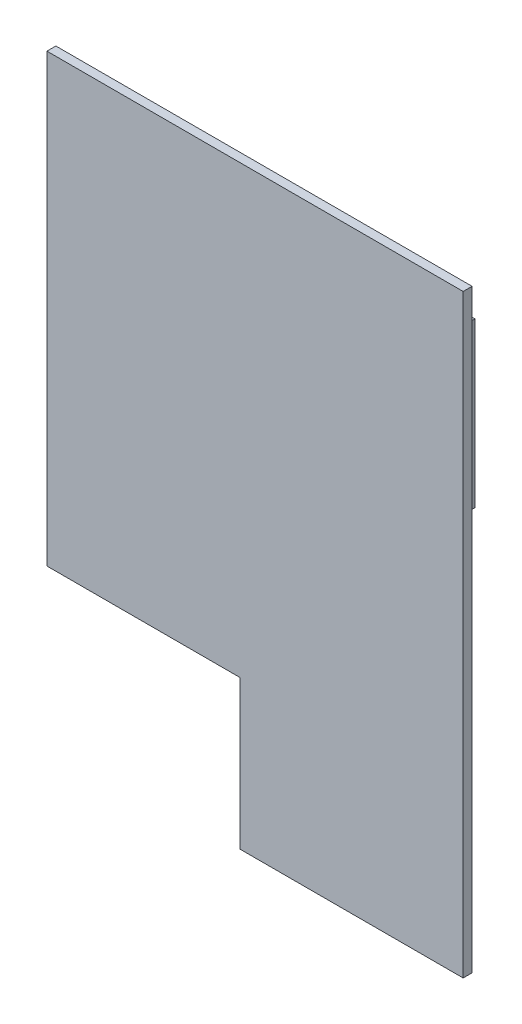
from build123d import *

# Parameters (mm, degrees)
SKETCH_1_W          = 140
SKETCH_1_H          = 200
EXTRUDE_1_DEPTH     = 3
SKETCH_2_W          = 65
SKETCH_2_H          = 50
CUT_EXTRUDE_1_DEPTH = 10
SKETCH_4_W          = 3
SKETCH_4_H          = 55
EXTRUDE_4_DEPTH     = 18
CUT_EXTRUDE_2_REACH = 244.211
SKETCH_5_R          = 1.5
SKETCH_6_W          = 18
SKETCH_6_H          = 55
SKETCH_6_R          = 1.5
EXTRUDE_6_DEPTH     = 3
CUT_EXTRUDE_3_REACH = 247.033
SKETCH_7_W          = 55.809018756
SKETCH_7_H          = 208.345061012
SKETCH_8_W          = 3
SKETCH_8_H          = 55
EXTRUDE_7_DEPTH     = 18
SKETCH_9_R          = 1.5
CUT_EXTRUDE_4_DEPTH = 10
SKETCH_10_W         = 3
SKETCH_10_H         = 55
CUT_EXTRUDE_5_DEPTH = 18


with BuildPart() as part:
    # 草图1 → 凸台-拉伸1 (new body)
    with BuildSketch(Plane.XY):
        with Locations((70, -100)):
            Rectangle(SKETCH_1_W, SKETCH_1_H)
    extrude_1 = extrude(amount=EXTRUDE_1_DEPTH)

    # 草图2 → 切除-拉伸1 (cut)
    with BuildSketch(Plane(origin=(0, 0, 0), x_dir=(-1, 0, 0), z_dir=(0, 0, -1))):
        with Locations((-32.5, -175)):
            Rectangle(SKETCH_2_W, SKETCH_2_H)
    cut_extrude_1 = extrude(amount=-CUT_EXTRUDE_1_DEPTH, mode=Mode.SUBTRACT)

    # 草图4 → 凸台-拉伸4 (add)
    with BuildSketch(Plane.XY.offset(3)):
        with Locations((6.5, -54.5)):
            Rectangle(SKETCH_4_W, SKETCH_4_H)
    extrude_4 = extrude(amount=EXTRUDE_4_DEPTH)

    # 草图5 → 切除-拉伸2 (cut, up to next)
    with BuildSketch(Plane.ZY.offset(-5), mode=Mode.PRIVATE) as cut_extrude_2_sk1:
        with Locations(Location((13, -76.16447412, 0), (0, 0, 270))):
            Circle(SKETCH_5_R)
    cut_extrude_2_tool1 = extrude(cut_extrude_2_sk1.sketch, amount=-CUT_EXTRUDE_2_REACH, mode=Mode.PRIVATE) & part.part
    # 草图5 → 切除-拉伸2 (cut, up to next)
    with BuildSketch(Plane.ZY.offset(-5), mode=Mode.PRIVATE) as cut_extrude_2_sk2:
        with Locations(Location((13, -36.16447412, 0), (0, 0, 270))):
            Circle(SKETCH_5_R)
    cut_extrude_2_tool2 = extrude(cut_extrude_2_sk2.sketch, amount=-CUT_EXTRUDE_2_REACH, mode=Mode.PRIVATE) & part.part
    cut_extrude_2_1 = cut_extrude_2_tool1.solids().sort_by_distance((5, -76.164474, 13))[0]
    add(cut_extrude_2_1, mode=Mode.SUBTRACT)
    cut_extrude_2_2 = cut_extrude_2_tool2.solids().sort_by_distance((5, -36.164474, 13))[0]
    add(cut_extrude_2_2, mode=Mode.SUBTRACT)
    cut_extrude_2 = cut_extrude_2_1 + cut_extrude_2_2  # 切除-拉伸2 as one shape, for the pattern or mirror that repeats it

    # 草图6 → 凸台-拉伸6 (add)
    with BuildSketch(Plane(origin=(128, 0, 0), x_dir=(0, 0, -1), z_dir=(1, 0, 0))):
        with Locations((-12, -54.5)):
            Rectangle(SKETCH_6_W, SKETCH_6_H)
        with Locations(Location((-13, -76.16447412, 0), (0, 0, 270))):
            Circle(SKETCH_6_R, mode=Mode.SUBTRACT)
        with Locations(Location((-13, -36.16447412, 0), (0, 0, 270))):
            Circle(SKETCH_6_R, mode=Mode.SUBTRACT)
    extrude_6 = extrude(amount=EXTRUDE_6_DEPTH)

    # 镜向1: 凸台-拉伸1, 切除-拉伸1, 凸台-拉伸4, 切除-拉伸2, 凸台-拉伸6 across plane
    add(extrude_1.mirror(Plane.XY))
    add(cut_extrude_1.mirror(Plane.XY), mode=Mode.SUBTRACT)
    add(extrude_4.mirror(Plane.XY))
    add(cut_extrude_2.mirror(Plane.XY), mode=Mode.SUBTRACT)
    add(extrude_6.mirror(Plane.XY))

    # 草图7 → 切除-拉伸3 (cut, up to next)
    with BuildSketch(Plane(origin=(140, 0, 0), x_dir=(0, 0, -1), z_dir=(1, 0, 0)), mode=Mode.PRIVATE) as cut_extrude_3_sk1:
        with Locations((-27.904509378, -104.172530506)):
            Rectangle(SKETCH_7_W, SKETCH_7_H)
    cut_extrude_3_tool1 = extrude(cut_extrude_3_sk1.sketch, amount=-CUT_EXTRUDE_3_REACH, mode=Mode.PRIVATE) & part.part
    add(cut_extrude_3_tool1.solids().sort_by_distance((140, -104.172531, 27.904509))[0], mode=Mode.SUBTRACT)

    # 草图8 → 凸台-拉伸7 (add)
    with BuildSketch(Plane(origin=(0, 0, -3), x_dir=(-1, 0, 0), z_dir=(0, 0, -1))):
        with Locations((-121.5, -54.5)):
            Rectangle(SKETCH_8_W, SKETCH_8_H)
    extrude(amount=EXTRUDE_7_DEPTH)

    # 草图9 → 切除-拉伸4 (cut)
    with BuildSketch(Plane.ZY.offset(-120)):
        with Locations(Location((-13, -36.16447412, 0), (0, 0, 270))):
            Circle(SKETCH_9_R)
        with Locations(Location((-13, -76.16447412, 0), (0, 0, 270))):
            Circle(SKETCH_9_R)
    extrude(amount=-CUT_EXTRUDE_4_DEPTH, mode=Mode.SUBTRACT)

    # 草图10 → 切除-拉伸5 (cut)
    with BuildSketch(Plane(origin=(0, 0, -21), x_dir=(-1, 0, 0), z_dir=(0, 0, -1))):
        with Locations((-129.5, -54.5)):
            Rectangle(SKETCH_10_W, SKETCH_10_H)
    extrude(amount=-CUT_EXTRUDE_5_DEPTH, mode=Mode.SUBTRACT)


solid = part.part
